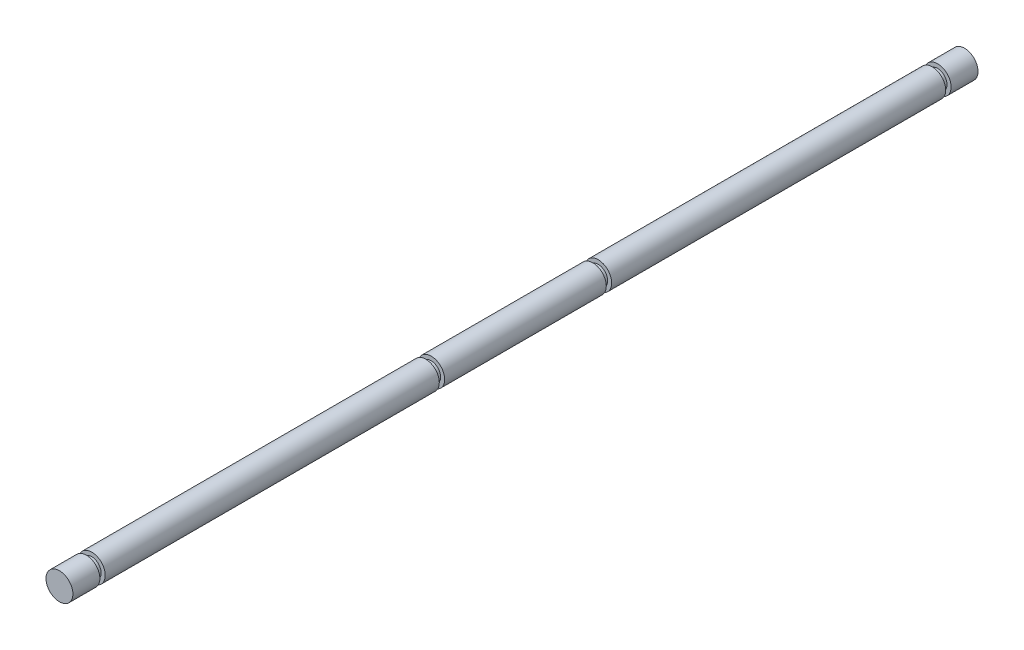
from build123d import *

# Parameters (mm, degrees)
SKETCH_1_R      = 5
EXTRUDE_1_DEPTH = 60
SKETCH_2_R      = 3.5
EXTRUDE_2_DEPTH = 2
EXTRUDE_START   = 2
SKETCH_3_R      = 3.5
EXTRUDE_3_DEPTH = 2
EXTRUDE_START_2 = 124
SKETCH_4_R      = 5
EXTRUDE_4_DEPTH = 124
SKETCH_5_R      = 5
EXTRUDE_5_DEPTH = 124
SKETCH_6_R      = 3.5
EXTRUDE_6_DEPTH = 2
SKETCH_7_R      = 5
EXTRUDE_7_DEPTH = 10
SKETCH_8_R      = 3.5
EXTRUDE_8_DEPTH = 2
EXTRUDE_START_3 = 10
SKETCH_9_R      = 5
EXTRUDE_9_DEPTH = 10


with BuildPart() as part:
    # 草图1 → 凸台-拉伸1 (new body)
    with BuildSketch(Plane.XY):
        Circle(SKETCH_1_R)
    extrude(amount=EXTRUDE_1_DEPTH)

    # 草图2 → 凸台-拉伸2 (add)
    with BuildSketch(Plane.XY.offset(60)):
        Circle(SKETCH_2_R)
    extrude(amount=EXTRUDE_2_DEPTH)

    # 草图3 → 凸台-拉伸3 (add)
    with BuildSketch(Plane(origin=(0, 0, 0), x_dir=(-1, 0, 0), z_dir=(0, 0, -1)).offset(EXTRUDE_START)):
        with Locations(Location((0, 0, 0), (0, 0, 180))):
            Circle(SKETCH_3_R)
    extrude(amount=-EXTRUDE_3_DEPTH)

    # 草图4 → 凸台-拉伸4 (add)
    with BuildSketch(Plane(origin=(0, 0, -2), x_dir=(-1, 0, 0), z_dir=(0, 0, -1)).offset(EXTRUDE_START_2)):
        with Locations(Location((0, 0, 0), (0, 0, 180))):
            Circle(SKETCH_4_R)
    extrude(amount=-EXTRUDE_4_DEPTH)

    # 草图5 → 凸台-拉伸5 (add)
    with BuildSketch(Plane.XY.offset(62)):
        Circle(SKETCH_5_R)
    extrude(amount=EXTRUDE_5_DEPTH)

    # 草图6 → 凸台-拉伸6 (add)
    with BuildSketch(Plane.XY.offset(186)):
        Circle(SKETCH_6_R)
    extrude(amount=EXTRUDE_6_DEPTH)

    # 草图7 → 凸台-拉伸7 (add)
    with BuildSketch(Plane.XY.offset(188)):
        Circle(SKETCH_7_R)
    extrude(amount=EXTRUDE_7_DEPTH)

    # 草图8 → 凸台-拉伸8 (add)
    with BuildSketch(Plane(origin=(0, 0, -126), x_dir=(-1, 0, 0), z_dir=(0, 0, -1)).offset(EXTRUDE_START)):
        with Locations(Location((0, 0, 0), (0, 0, 180))):
            Circle(SKETCH_8_R)
    extrude(amount=-EXTRUDE_8_DEPTH)

    # 草图9 → 凸台-拉伸9 (add)
    with BuildSketch(Plane(origin=(0, 0, -128), x_dir=(-1, 0, 0), z_dir=(0, 0, -1)).offset(EXTRUDE_START_3)):
        with Locations(Location((0, 0, 0), (0, 0, 180))):
            Circle(SKETCH_9_R)
    extrude(amount=-EXTRUDE_9_DEPTH)


solid = part.part
